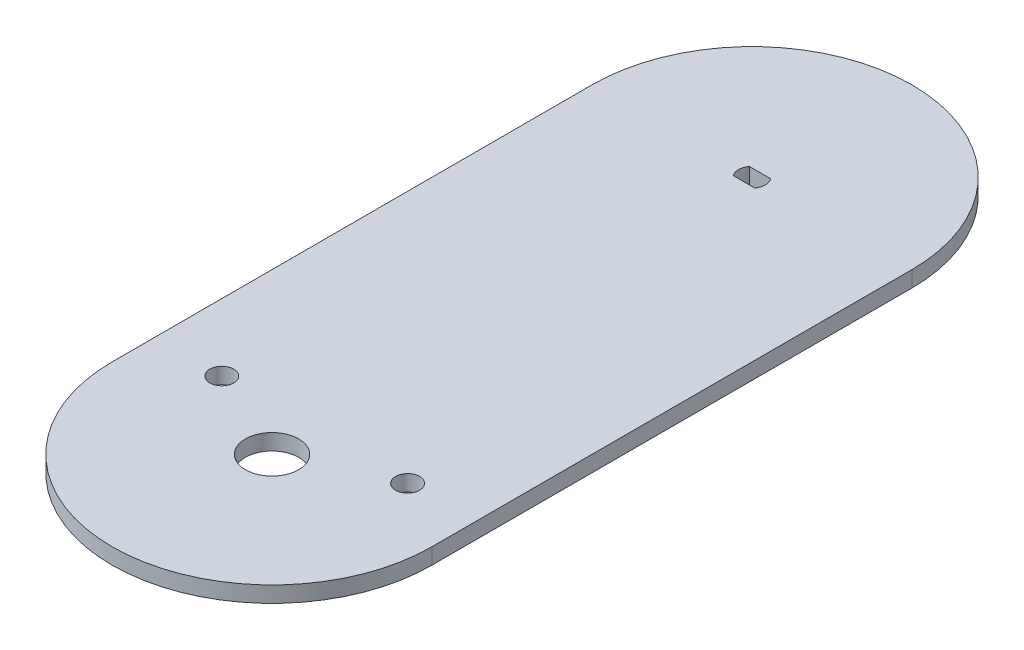
from build123d import *

# Parameters (mm, degrees)
SKETCH1_R           = 5
SKETCH1_R_2         = 2.25
BOSS_EXTRUDE1_DEPTH = 3


with BuildPart() as part:
    # Sketch1 → Boss-Extrude1 (new body)
    with BuildSketch(Plane(origin=(0, 0, 0), x_dir=(1, 0, 0), z_dir=(0, 1, 0))):
        with BuildLine():
            Line((-30, 0), (-30, -90))
            ThreePointArc((-30, -90), (0, -120), (30, -90))
            Line((30, -90), (30, 0))
            ThreePointArc((30, 0), (0, 30), (-30, 0))
        make_face()
        with Locations(Location((0, -90, 0), (0, 0, 270))):
            Circle(SKETCH1_R, mode=Mode.SUBTRACT)
        with Locations(Location((-17.425, -82, 0), (0, 0, 270))):
            Circle(SKETCH1_R_2, mode=Mode.SUBTRACT)
        with Locations(Location((17.425, -82, 0), (0, 0, 270))):
            Circle(SKETCH1_R_2, mode=Mode.SUBTRACT)
        with BuildLine():
            Line((-2, -1.5), (2, -1.5))
            ThreePointArc((2, -1.5), (2.5, 0), (2, 1.5))
            Line((2, 1.5), (-2, 1.5))
            ThreePointArc((-2, 1.5), (-2.5, 0), (-2, -1.5))
        make_face(mode=Mode.SUBTRACT)
    extrude(amount=BOSS_EXTRUDE1_DEPTH)


solid = part.part
